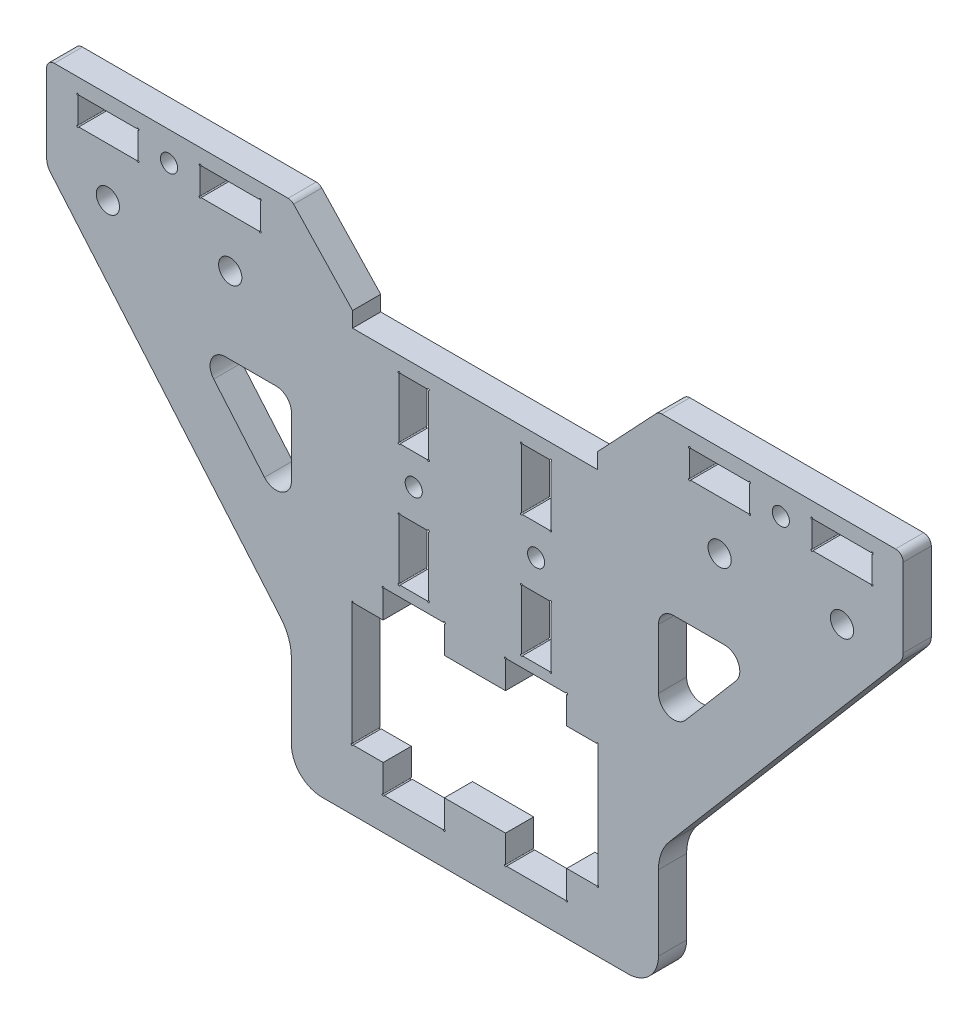
from build123d import *

# Parameters (mm, degrees)
SKETCH1_R           = 2.413
SKETCH1_R_2         = 1.778
SKETCH1_W           = 12.5
SKETCH1_H           = 5.742
SKETCH1_W_2         = 51
SKETCH1_H_2         = 25.6
BOSS_EXTRUDE1_DEPTH = 5.842
FILLET1_R           = 6.35
FILLET2_R           = 3.175
FILLET3_R           = 3.175
FILLET4_R           = 1.5875
FILLET5_R           = 9.525
SKETCH2_R           = 1.778
SKETCH2_W           = 6.096
SKETCH2_H           = 12.7
CUT_EXTRUDE1_DEPTH  = 164.664917246
SKETCH3_R           = 0.1984375
CUT_EXTRUDE2_DEPTH  = 164.664917246
SKETCH5_R           = 0.1984375
CUT_EXTRUDE3_DEPTH  = 164.664917246
SKETCH9_W           = 12.7
SKETCH9_H           = 5.842
SKETCH9_W_2         = 5.842
SKETCH9_H_2         = 12.7
CUT_EXTRUDE6_DEPTH  = 164.664917246
SKETCH10_R          = 0.1984375
CUT_EXTRUDE7_DEPTH  = 164.664917246
BOSS_EXTRUDE3_DEPTH = 5.842


with BuildPart() as part:
    # Sketch1 → Boss-Extrude1 (new body)
    with BuildSketch(Plane.XY):
        Polygon((-25.4, 2.435399968), (-76.2, 2.435399968), (-76.2, 5.610399968), (-88.9, 19.1024), (-139.7, 19.1024), (-139.7, 0), (-88.9, -59.6646), (-88.9, -85.0646), (-12.7, -85.0646), (-12.7, -59.6646), (38.1, 0), (38.1, 19.1024), (-12.7, 19.1024), (-25.4, 5.610399968), align=None)
        Circle(SKETCH1_R, mode=Mode.SUBTRACT)
        with Locations((25.4, 0)):
            Circle(SKETCH1_R, mode=Mode.SUBTRACT)
        with Locations((12.7, 13.0564)):
            Circle(SKETCH1_R_2, mode=Mode.SUBTRACT)
        with Locations((-114.3, 13.0564)):
            Circle(SKETCH1_R_2, mode=Mode.SUBTRACT)
        with Locations((-127, 0)):
            Circle(SKETCH1_R, mode=Mode.SUBTRACT)
        with Locations((-101.6, 0)):
            Circle(SKETCH1_R, mode=Mode.SUBTRACT)
        with Locations((0, 13.0564)):
            Rectangle(SKETCH1_W, SKETCH1_H, mode=Mode.SUBTRACT)
        with Locations((25.4, 13.0564)):
            Rectangle(SKETCH1_W, SKETCH1_H, mode=Mode.SUBTRACT)
        with Locations((-50.8, -59.6646)):
            Rectangle(SKETCH1_W_2, SKETCH1_H_2, mode=Mode.SUBTRACT)
        Polygon((-12.7, -40.074257205), (7.882845549, -15.899705108), (-12.7, -15.899705108), align=None, mode=Mode.SUBTRACT)
        Polygon((-88.9, -15.899705108), (-109.482845549, -15.899705108), (-88.9, -40.074257205), align=None, mode=Mode.SUBTRACT)
        with Locations((-101.6, 13.0564)):
            Rectangle(SKETCH1_W, SKETCH1_H, mode=Mode.SUBTRACT)
        with Locations((-127, 13.0564)):
            Rectangle(SKETCH1_W, SKETCH1_H, mode=Mode.SUBTRACT)
    extrude(amount=BOSS_EXTRUDE1_DEPTH)

    # Fillet1
    fillet1_edges = [part.edges().sort_by_distance(p)[0] for p in [
        (-12.7, -85.0646, 2.921),
        (-88.9, -85.0646, 2.921),
    ]]
    fillet(fillet1_edges, radius=FILLET1_R)

    # Fillet2
    fillet2_edges = [part.edges().sort_by_distance(p)[0] for p in [
        (-12.7, -40.074257205, 2.921),
        (7.882845549, -15.899705108, 2.921),
        (-12.7, -15.899705108, 2.921),
        (-88.9, -15.899705108, 2.921),
        (-109.482845549, -15.899705108, 2.921),
        (-88.9, -40.074257205, 2.921),
    ]]
    fillet(fillet2_edges, radius=FILLET2_R)

    # Fillet3
    fillet3_edges = [part.edges().sort_by_distance(p)[0] for p in [
        (-139.7, 0, 2.921),
        (38.1, 0, 2.921),
    ]]
    fillet(fillet3_edges, radius=FILLET3_R)

    # Fillet4
    fillet4_edges = [part.edges().sort_by_distance(p)[0] for p in [
        (-139.7, 19.1024, 2.921),
        (-88.9, 19.1024, 2.921),
        (-12.7, 19.1024, 2.921),
        (38.1, 19.1024, 2.921),
    ]]
    fillet(fillet4_edges, radius=FILLET4_R)

    # Fillet5
    fillet5_edges = [part.edges().sort_by_distance(p)[0] for p in [
        (-88.9, -59.6646, 2.921),
        (-12.7, -59.6646, 2.921),
    ]]
    fillet(fillet5_edges, radius=FILLET5_R)

    # Sketch2 → Cut-Extrude1 (cut, through all)
    with BuildSketch(Plane.XY.offset(5.842)):
        with Locations((-38.1, -19.789600032)):
            Circle(SKETCH2_R)
        with Locations(Location((-63.5, -19.789600032, 0), (0, 0, 180))):
            Circle(SKETCH2_R)
        with Locations((-38.1, -7.089600032)):
            Rectangle(SKETCH2_W, SKETCH2_H)
        with Locations((-38.1, -32.489600032)):
            Rectangle(SKETCH2_W, SKETCH2_H)
        with Locations((-63.5, -32.489600032)):
            Rectangle(SKETCH2_W, SKETCH2_H)
        with Locations((-63.5, -7.089600032)):
            Rectangle(SKETCH2_W, SKETCH2_H)
    extrude(amount=-CUT_EXTRUDE1_DEPTH, mode=Mode.SUBTRACT)

    # Sketch3 → Cut-Extrude2 (cut, through all)
    with BuildSketch(Plane.XY.offset(5.842)):
        with Locations((-35.052, -26.139600032)):
            Circle(SKETCH3_R)
        with Locations((-41.148, -26.139600032)):
            Circle(SKETCH3_R)
        with Locations((-35.052, -38.839600032)):
            Circle(SKETCH3_R)
        with Locations((-41.148, -38.839600032)):
            Circle(SKETCH3_R)
        with Locations((-35.052, -0.739600032)):
            Circle(SKETCH3_R)
        with Locations((-35.052, -13.439600032)):
            Circle(SKETCH3_R)
        with Locations((-41.148, -13.439600032)):
            Circle(SKETCH3_R)
        with Locations((-41.148, -0.739600032)):
            Circle(SKETCH3_R)
        with Locations((-60.452, -0.739600032)):
            Circle(SKETCH3_R)
        with Locations((-60.452, -13.439600032)):
            Circle(SKETCH3_R)
        with Locations((-66.548, -13.439600032)):
            Circle(SKETCH3_R)
        with Locations((-66.548, -0.739600032)):
            Circle(SKETCH3_R)
        with Locations((-60.452, -38.839600032)):
            Circle(SKETCH3_R)
        with Locations((-66.548, -38.839600032)):
            Circle(SKETCH3_R)
        with Locations((-60.452, -26.139600032)):
            Circle(SKETCH3_R)
        with Locations((-66.548, -26.139600032)):
            Circle(SKETCH3_R)
    extrude(amount=-CUT_EXTRUDE2_DEPTH, mode=Mode.SUBTRACT)

    # Sketch5 → Cut-Extrude3 (cut, through all)
    with BuildSketch(Plane.XY.offset(5.842)):
        with Locations((31.65, 15.9274)):
            Circle(SKETCH5_R)
        with Locations((31.65, 10.1854)):
            Circle(SKETCH5_R)
        with Locations((19.15, 10.1854)):
            Circle(SKETCH5_R)
        with Locations((19.15, 15.9274)):
            Circle(SKETCH5_R)
        with Locations((6.25, 15.9274)):
            Circle(SKETCH5_R)
        with Locations((6.25, 10.1854)):
            Circle(SKETCH5_R)
        with Locations((-6.25, 15.9274)):
            Circle(SKETCH5_R)
        with Locations((-6.25, 10.1854)):
            Circle(SKETCH5_R)
        with Locations((-95.35, 10.1854)):
            Circle(SKETCH5_R)
        with Locations((-95.35, 15.9274)):
            Circle(SKETCH5_R)
        with Locations((-107.85, 10.1854)):
            Circle(SKETCH5_R)
        with Locations((-107.85, 15.9274)):
            Circle(SKETCH5_R)
        with Locations((-120.75, 15.9274)):
            Circle(SKETCH5_R)
        with Locations((-120.75, 10.1854)):
            Circle(SKETCH5_R)
        with Locations((-133.25, 10.1854)):
            Circle(SKETCH5_R)
        with Locations((-133.25, 15.9274)):
            Circle(SKETCH5_R)
        with Locations((-25.3, -46.8646)):
            Circle(SKETCH5_R)
        with Locations((-25.3, -72.4646)):
            Circle(SKETCH5_R)
        with Locations((-76.3, -72.4646)):
            Circle(SKETCH5_R)
        with Locations((-76.3, -46.8646)):
            Circle(SKETCH5_R)
    extrude(amount=-CUT_EXTRUDE3_DEPTH, mode=Mode.SUBTRACT)

    # Sketch9 → Cut-Extrude6 (cut, through all)
    with BuildSketch(Plane.XY.offset(5.842)):
        with Locations((-63.5, -43.9436)):
            Rectangle(SKETCH9_W, SKETCH9_H)
        with Locations((-38.1, -43.9436)):
            Rectangle(SKETCH9_W, SKETCH9_H)
        with Locations((-38.1, -75.3856)):
            Rectangle(SKETCH9_W, SKETCH9_H)
        with Locations((-63.5, -75.3856)):
            Rectangle(SKETCH9_W, SKETCH9_H)
        with Locations((-79.221, -59.6646)):
            Rectangle(SKETCH9_W_2, SKETCH9_H_2)
        with Locations((-22.379, -59.6646)):
            Rectangle(SKETCH9_W_2, SKETCH9_H_2)
        with Locations((-22.379, -34.2646)):
            Rectangle(SKETCH9_W_2, SKETCH9_H_2)
        with Locations((-22.379, -8.8646)):
            Rectangle(SKETCH9_W_2, SKETCH9_H_2)
        with Locations((-79.221, -8.8646)):
            Rectangle(SKETCH9_W_2, SKETCH9_H_2)
        with Locations((-79.221, -34.2646)):
            Rectangle(SKETCH9_W_2, SKETCH9_H_2)
    extrude(amount=-CUT_EXTRUDE6_DEPTH, mode=Mode.SUBTRACT)

    # Sketch10 → Cut-Extrude7 (cut, through all)
    with BuildSketch(Plane.XY.offset(5.842)):
        with Locations((-44.45, -41.0226)):
            Circle(SKETCH10_R)
        with Locations((-31.75, -41.0226)):
            Circle(SKETCH10_R)
        with Locations((-19.458, -53.3146)):
            Circle(SKETCH10_R)
        with Locations((-19.458, -66.0146)):
            Circle(SKETCH10_R)
        with Locations((-31.75, -78.3066)):
            Circle(SKETCH10_R)
        with Locations((-44.45, -78.3066)):
            Circle(SKETCH10_R)
        with Locations((-57.15, -78.3066)):
            Circle(SKETCH10_R)
        with Locations((-69.85, -78.3066)):
            Circle(SKETCH10_R)
        with Locations((-82.142, -66.0146)):
            Circle(SKETCH10_R)
        with Locations((-82.142, -53.3146)):
            Circle(SKETCH10_R)
        with Locations((-69.85, -41.0226)):
            Circle(SKETCH10_R)
        with Locations((-57.15, -41.0226)):
            Circle(SKETCH10_R)
        with Locations((-19.458, -40.6146)):
            Circle(SKETCH10_R)
        with Locations((-25.3, -40.6146)):
            Circle(SKETCH10_R)
        with Locations((-25.3, -27.9146)):
            Circle(SKETCH10_R)
        with Locations((-19.458, -27.9146)):
            Circle(SKETCH10_R)
        with Locations((-19.458, -15.2146)):
            Circle(SKETCH10_R)
        with Locations((-25.3, -15.2146)):
            Circle(SKETCH10_R)
        with Locations((-19.458, -2.5146)):
            Circle(SKETCH10_R)
        with Locations((-25.3, -2.5146)):
            Circle(SKETCH10_R)
        with Locations((-76.3, -2.5146)):
            Circle(SKETCH10_R)
        with Locations((-82.142, -2.5146)):
            Circle(SKETCH10_R)
        with Locations((-76.3, -15.2146)):
            Circle(SKETCH10_R)
        with Locations((-82.142, -15.2146)):
            Circle(SKETCH10_R)
        with Locations((-82.142, -27.9146)):
            Circle(SKETCH10_R)
        with Locations((-76.3, -27.9146)):
            Circle(SKETCH10_R)
        with Locations((-76.3, -40.6146)):
            Circle(SKETCH10_R)
        with Locations((-82.142, -40.6146)):
            Circle(SKETCH10_R)
    extrude(amount=-CUT_EXTRUDE7_DEPTH, mode=Mode.SUBTRACT)

    # Sketch11 → Boss-Extrude3 (add)
    with BuildSketch(Plane.XY.offset(5.842)):
        Polygon((-84.00501892, 0), (-76.3, 0), (-72.61548557, 0), (-72.61548557, -41.754133064), (-76.3, -41.754133064), (-76.3, -70.239806385), (-84.00501892, -70.239806385), align=None)
        Polygon((-25.3, -41.754133064), (-25.3, -70.239806385), (-17.59498108, -70.239806385), (-17.59498108, 0), (-25.3, 0), (-28.98451443, 0), (-28.98451443, -41.754133064), align=None)
    extrude(amount=-BOSS_EXTRUDE3_DEPTH)


solid = part.part
